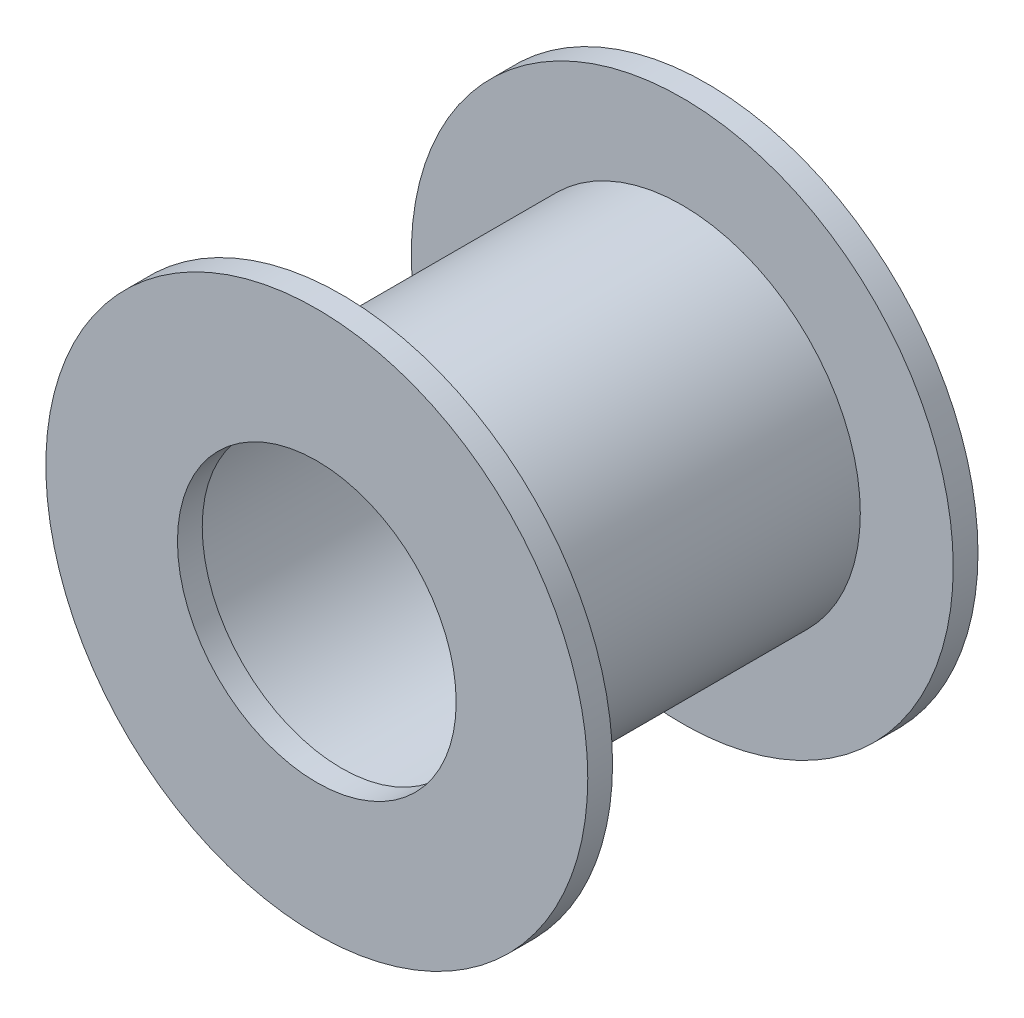
from build123d import *

# Parameters (mm, degrees)
SKETCH_1_R          = 175
EXTRUDE_1_DEPTH     = 16
SKETCH_2_R          = 115
SKETCH_2_R_2        = 105
EXTRUDE_2_DEPTH     = 220
SKETCH_3_R          = 175
EXTRUDE_3_DEPTH     = 16
SKETCH_4_R          = 90
CUT_EXTRUDE_1_DEPTH = 354.205322723


with BuildPart() as part:
    # 草图1 → 凸台-拉伸1 (new body)
    with BuildSketch(Plane.XY):
        Circle(SKETCH_1_R)
    extrude(amount=EXTRUDE_1_DEPTH)


with BuildPart() as body_2:
    # 草图2 → 凸台-拉伸2 (new body)
    with BuildSketch(Plane.XY.offset(16)):
        Circle(SKETCH_2_R)
        Circle(SKETCH_2_R_2, mode=Mode.SUBTRACT)
    extrude(amount=EXTRUDE_2_DEPTH)


with BuildPart() as body_3:
    # 草图3 → 凸台-拉伸3 (new body)
    with BuildSketch(Plane.XY.offset(236)):
        Circle(SKETCH_3_R)
    extrude(amount=EXTRUDE_3_DEPTH)


with BuildPart() as cut_extrude_1_tool:
    # 草图4 → 切除-拉伸1 (new, through all)
    with BuildSketch(Plane.XY.offset(252)):
        Circle(SKETCH_4_R)
    extrude(amount=-CUT_EXTRUDE_1_DEPTH)


with BuildPart() as part_1:
    add(part.part)

    # 切除-拉伸1: cut by cut_extrude_1_tool
    add(cut_extrude_1_tool.part, mode=Mode.SUBTRACT)


with BuildPart() as body_3_1:
    add(body_3.part)

    # 切除-拉伸1: cut by cut_extrude_1_tool
    add(cut_extrude_1_tool.part, mode=Mode.SUBTRACT)


solid = Compound([body_2.part, part_1.part, body_3_1.part])
